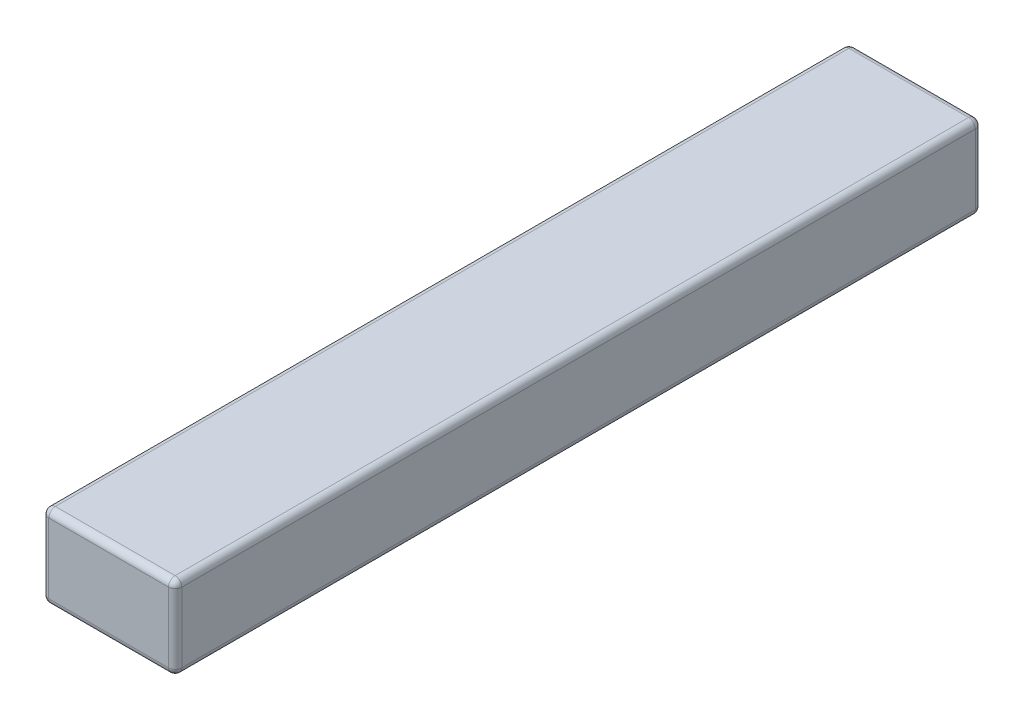
from build123d import *

# Parameters (mm, degrees)
SKETCH1_W           = 80
SKETCH1_H           = 50
BOSS_EXTRUDE1_DEPTH = 485
FILLET1_R           = 4


with BuildPart() as part:
    # Sketch1 → Boss-Extrude1 (new body)
    with BuildSketch(Plane.XY):
        with Locations((40, -25)):
            Rectangle(SKETCH1_W, SKETCH1_H)
    extrude(amount=BOSS_EXTRUDE1_DEPTH)

    # Fillet1
    fillet1_edges = [part.edges().sort_by_distance(p)[0] for p in [
        (80, -25, 485),
        (40, 0, 485),
        (0, -25, 485),
        (40, 0, 0),
        (80, -25, 0),
        (40, -50, 0),
        (0, -25, 0),
        (0, 0, 242.5),
        (80, 0, 242.5),
        (80, -50, 242.5),
        (0, -50, 242.5),
        (40, -50, 485),
    ]]
    fillet(fillet1_edges, radius=FILLET1_R)


solid = part.part
